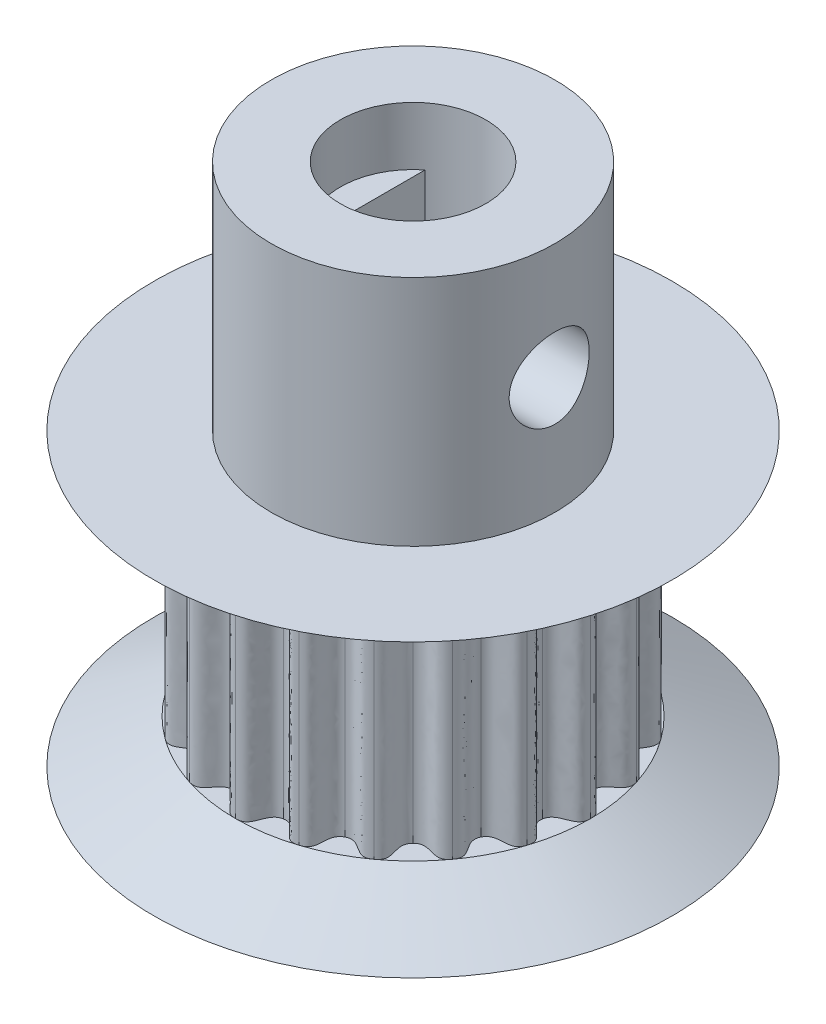
from build123d import *
from build123d.topology import SkipClean

# Parameters (mm, degrees)
BOSS_EXTRUDE3_DEPTH     = 3.5
SKETCH4_R               = 8.9
SKETCH3_R               = 6.1
SKETCH5_R               = 4.875
SKETCH5_R_2             = 2.5
BOSS_EXTRUDE4_DEPTH     = 8
CUT_EXTRUDE1_REACH      = 20.905
CUT_EXTRUDE1_END_RADIUS = 4.875
SKETCH6_R               = 1.375
SKETCH7_R               = 2.5
CUT_EXTRUDE2_DEPTH      = 2


with BuildPart() as part:
    # Sketch2 → Boss-Extrude3 (new, symmetric)
    with BuildSketch(Plane(origin=(0, 0, 0), x_dir=(1, 0, 0), z_dir=(0, 1, 0))):
        with BuildLine():
            add(Edge.make_bspline(
                [(0, 6.1), (0.152993891, 6.1), (0.490238058, 5.941777113), (0.471642161, 5.341987643), (0.836924388, 5.284132622)],
                knots=[0, 0, 0, 0, 0.268002773, 1, 1, 1, 1], degree=3))
            add(Edge.make_bspline(
                [(1.885003666, 5.801444749), (1.739497829, 5.848722462), (1.369866005, 5.802457733), (1.202206615, 5.226277601), (0.836924388, 5.284132622)],
                knots=[0, 0, 0, 0, 0.268002773, 1, 1, 1, 1], degree=3))
            add(Edge.make_bspline(
                [(1.885003666, 5.801444749), (2.030509503, 5.754167037), (2.302354204, 5.499473951), (2.099323316, 4.934786715), (2.428849174, 4.766884904)],
                knots=[0, 0, 0, 0, 0.268002773, 1, 1, 1, 1], degree=3))
            add(Edge.make_bspline(
                [(3.585490039, 4.935003666), (3.461715381, 5.024931219), (3.095878039, 5.095153362), (2.758375031, 4.598983094), (2.428849174, 4.766884904)],
                knots=[0, 0, 0, 0, 0.268002773, 1, 1, 1, 1], degree=3))
            add(Edge.make_bspline(
                [(3.585490039, 4.935003666), (3.709264697, 4.845076113), (3.88909988, 4.518843961), (3.521508078, 4.044534481), (3.783021279, 3.783021279)],
                knots=[0, 0, 0, 0, 0.268002773, 1, 1, 1, 1], degree=3))
            add(Edge.make_bspline(
                [(4.935003666, 3.585490039), (4.845076113, 3.709264697), (4.518843961, 3.88909988), (4.044534481, 3.521508078), (3.783021279, 3.783021279)],
                knots=[0, 0, 0, 0, 0.268002773, 1, 1, 1, 1], degree=3))
            add(Edge.make_bspline(
                [(4.935003666, 3.585490039), (5.024931219, 3.461715381), (5.095153362, 3.095878039), (4.598983094, 2.758375031), (4.766884904, 2.428849174)],
                knots=[0, 0, 0, 0, 0.268002773, 1, 1, 1, 1], degree=3))
            add(Edge.make_bspline(
                [(5.801444749, 1.885003666), (5.754167037, 2.030509503), (5.499473951, 2.302354204), (4.934786715, 2.099323316), (4.766884904, 2.428849174)],
                knots=[0, 0, 0, 0, 0.268002773, 1, 1, 1, 1], degree=3))
            add(Edge.make_bspline(
                [(5.801444749, 1.885003666), (5.848722462, 1.739497829), (5.802457733, 1.369866005), (5.226277601, 1.202206615), (5.284132622, 0.836924388)],
                knots=[0, 0, 0, 0, 0.268002773, 1, 1, 1, 1], degree=3))
            add(Edge.make_bspline(
                [(6.1, 0), (6.1, 0.152993891), (5.941777113, 0.490238058), (5.341987643, 0.471642161), (5.284132622, 0.836924388)],
                knots=[0, 0, 0, 0, 0.268002773, 1, 1, 1, 1], degree=3))
            add(Edge.make_bspline(
                [(6.1, 0), (6.1, -0.152993891), (5.941777113, -0.490238058), (5.341987643, -0.471642161), (5.284132622, -0.836924388)],
                knots=[0, 0, 0, 0, 0.268002773, 1, 1, 1, 1], degree=3))
            add(Edge.make_bspline(
                [(5.801444749, -1.885003666), (5.848722462, -1.739497829), (5.802457733, -1.369866005), (5.226277601, -1.202206615), (5.284132622, -0.836924388)],
                knots=[0, 0, 0, 0, 0.268002773, 1, 1, 1, 1], degree=3))
            add(Edge.make_bspline(
                [(5.801444749, -1.885003666), (5.754167037, -2.030509503), (5.499473951, -2.302354204), (4.934786715, -2.099323316), (4.766884904, -2.428849174)],
                knots=[0, 0, 0, 0, 0.268002773, 1, 1, 1, 1], degree=3))
            add(Edge.make_bspline(
                [(4.935003666, -3.585490039), (5.024931219, -3.461715381), (5.095153362, -3.095878039), (4.598983094, -2.758375031), (4.766884904, -2.428849174)],
                knots=[0, 0, 0, 0, 0.268002773, 1, 1, 1, 1], degree=3))
            add(Edge.make_bspline(
                [(4.935003666, -3.585490039), (4.845076113, -3.709264697), (4.518843961, -3.88909988), (4.044534481, -3.521508078), (3.783021279, -3.783021279)],
                knots=[0, 0, 0, 0, 0.268002773, 1, 1, 1, 1], degree=3))
            add(Edge.make_bspline(
                [(3.585490039, -4.935003666), (3.709264697, -4.845076113), (3.88909988, -4.518843961), (3.521508078, -4.044534481), (3.783021279, -3.783021279)],
                knots=[0, 0, 0, 0, 0.268002773, 1, 1, 1, 1], degree=3))
            add(Edge.make_bspline(
                [(3.585490039, -4.935003666), (3.461715381, -5.024931219), (3.095878039, -5.095153362), (2.758375031, -4.598983094), (2.428849174, -4.766884904)],
                knots=[0, 0, 0, 0, 0.268002773, 1, 1, 1, 1], degree=3))
            add(Edge.make_bspline(
                [(1.885003666, -5.801444749), (2.030509503, -5.754167037), (2.302354204, -5.499473951), (2.099323316, -4.934786715), (2.428849174, -4.766884904)],
                knots=[0, 0, 0, 0, 0.268002773, 1, 1, 1, 1], degree=3))
            add(Edge.make_bspline(
                [(1.885003666, -5.801444749), (1.739497829, -5.848722462), (1.369866005, -5.802457733), (1.202206615, -5.226277601), (0.836924388, -5.284132622)],
                knots=[0, 0, 0, 0, 0.268002773, 1, 1, 1, 1], degree=3))
            add(Edge.make_bspline(
                [(0, -6.1), (0.152993891, -6.1), (0.490238058, -5.941777113), (0.471642161, -5.341987643), (0.836924388, -5.284132622)],
                knots=[0, 0, 0, 0, 0.268002773, 1, 1, 1, 1], degree=3))
            add(Edge.make_bspline(
                [(0, -6.1), (-0.152993891, -6.1), (-0.490238058, -5.941777113), (-0.471642161, -5.341987643), (-0.836924388, -5.284132622)],
                knots=[0, 0, 0, 0, 0.268002773, 1, 1, 1, 1], degree=3))
            add(Edge.make_bspline(
                [(-1.885003666, -5.801444749), (-1.739497829, -5.848722462), (-1.369866005, -5.802457733), (-1.202206615, -5.226277601), (-0.836924388, -5.284132622)],
                knots=[0, 0, 0, 0, 0.268002773, 1, 1, 1, 1], degree=3))
            add(Edge.make_bspline(
                [(-1.885003666, -5.801444749), (-2.030509503, -5.754167037), (-2.302354204, -5.499473951), (-2.099323316, -4.934786715), (-2.428849174, -4.766884904)],
                knots=[0, 0, 0, 0, 0.268002773, 1, 1, 1, 1], degree=3))
            add(Edge.make_bspline(
                [(-3.585490039, -4.935003666), (-3.461715381, -5.024931219), (-3.095878039, -5.095153362), (-2.758375031, -4.598983094), (-2.428849174, -4.766884904)],
                knots=[0, 0, 0, 0, 0.268002773, 1, 1, 1, 1], degree=3))
            add(Edge.make_bspline(
                [(-3.585490039, -4.935003666), (-3.709264697, -4.845076113), (-3.88909988, -4.518843961), (-3.521508078, -4.044534481), (-3.783021279, -3.783021279)],
                knots=[0, 0, 0, 0, 0.268002773, 1, 1, 1, 1], degree=3))
            add(Edge.make_bspline(
                [(-4.935003666, -3.585490039), (-4.845076113, -3.709264697), (-4.518843961, -3.88909988), (-4.044534481, -3.521508078), (-3.783021279, -3.783021279)],
                knots=[0, 0, 0, 0, 0.268002773, 1, 1, 1, 1], degree=3))
            add(Edge.make_bspline(
                [(-4.935003666, -3.585490039), (-5.024931219, -3.461715381), (-5.095153362, -3.095878039), (-4.598983094, -2.758375031), (-4.766884904, -2.428849174)],
                knots=[0, 0, 0, 0, 0.268002773, 1, 1, 1, 1], degree=3))
            add(Edge.make_bspline(
                [(-5.801444749, -1.885003666), (-5.754167037, -2.030509503), (-5.499473951, -2.302354204), (-4.934786715, -2.099323316), (-4.766884904, -2.428849174)],
                knots=[0, 0, 0, 0, 0.268002773, 1, 1, 1, 1], degree=3))
            add(Edge.make_bspline(
                [(-5.801444749, -1.885003666), (-5.848722462, -1.739497829), (-5.802457733, -1.369866005), (-5.226277601, -1.202206615), (-5.284132622, -0.836924388)],
                knots=[0, 0, 0, 0, 0.268002773, 1, 1, 1, 1], degree=3))
            add(Edge.make_bspline(
                [(-6.1, 0), (-6.1, -0.152993891), (-5.941777113, -0.490238058), (-5.341987643, -0.471642161), (-5.284132622, -0.836924388)],
                knots=[0, 0, 0, 0, 0.268002773, 1, 1, 1, 1], degree=3))
            add(Edge.make_bspline(
                [(-6.1, 0), (-6.1, 0.152993891), (-5.941777113, 0.490238058), (-5.341987643, 0.471642161), (-5.284132622, 0.836924388)],
                knots=[0, 0, 0, 0, 0.268002773, 1, 1, 1, 1], degree=3))
            add(Edge.make_bspline(
                [(-5.801444749, 1.885003666), (-5.848722462, 1.739497829), (-5.802457733, 1.369866005), (-5.226277601, 1.202206615), (-5.284132622, 0.836924388)],
                knots=[0, 0, 0, 0, 0.268002773, 1, 1, 1, 1], degree=3))
            add(Edge.make_bspline(
                [(-5.801444749, 1.885003666), (-5.754167037, 2.030509503), (-5.499473951, 2.302354204), (-4.934786715, 2.099323316), (-4.766884904, 2.428849174)],
                knots=[0, 0, 0, 0, 0.268002773, 1, 1, 1, 1], degree=3))
            add(Edge.make_bspline(
                [(-4.935003666, 3.585490039), (-5.024931219, 3.461715381), (-5.095153362, 3.095878039), (-4.598983094, 2.758375031), (-4.766884904, 2.428849174)],
                knots=[0, 0, 0, 0, 0.268002773, 1, 1, 1, 1], degree=3))
            add(Edge.make_bspline(
                [(-4.935003666, 3.585490039), (-4.845076113, 3.709264697), (-4.518843961, 3.88909988), (-4.044534481, 3.521508078), (-3.783021279, 3.783021279)],
                knots=[0, 0, 0, 0, 0.268002773, 1, 1, 1, 1], degree=3))
            add(Edge.make_bspline(
                [(-3.585490039, 4.935003666), (-3.709264697, 4.845076113), (-3.88909988, 4.518843961), (-3.521508078, 4.044534481), (-3.783021279, 3.783021279)],
                knots=[0, 0, 0, 0, 0.268002773, 1, 1, 1, 1], degree=3))
            add(Edge.make_bspline(
                [(-3.585490039, 4.935003666), (-3.461715381, 5.024931219), (-3.095878039, 5.095153362), (-2.758375031, 4.598983094), (-2.428849174, 4.766884904)],
                knots=[0, 0, 0, 0, 0.268002773, 1, 1, 1, 1], degree=3))
            add(Edge.make_bspline(
                [(-1.885003666, 5.801444749), (-2.030509503, 5.754167037), (-2.302354204, 5.499473951), (-2.099323316, 4.934786715), (-2.428849174, 4.766884904)],
                knots=[0, 0, 0, 0, 0.268002773, 1, 1, 1, 1], degree=3))
            add(Edge.make_bspline(
                [(-1.885003666, 5.801444749), (-1.739497829, 5.848722462), (-1.369866005, 5.802457733), (-1.202206615, 5.226277601), (-0.836924388, 5.284132622)],
                knots=[0, 0, 0, 0, 0.268002773, 1, 1, 1, 1], degree=3))
            add(Edge.make_bspline(
                [(0, 6.1), (-0.152993891, 6.1), (-0.490238058, 5.941777113), (-0.471642161, 5.341987643), (-0.836924388, 5.284132622)],
                knots=[0, 0, 0, 0, 0.268002773, 1, 1, 1, 1], degree=3))
        make_face()
    extrude(amount=BOSS_EXTRUDE3_DEPTH, both=True)


with BuildPart() as body_2:
    # Sketch4 → Loft1 section 0
    with BuildSketch(Plane(origin=(0, -5, 0), x_dir=(-1, 0, 0), z_dir=(0, -1, 0))):
        Circle(SKETCH4_R)
    # Sketch3 → Loft1 section 1
    with BuildSketch(Plane.XZ.offset(3.5)):
        Circle(SKETCH3_R)
    loft()


with BuildPart() as body_3:
    # Mirror1: mirrored copy
    add(body_2.part.mirror(Plane.ZX))


with BuildPart() as body_2_1:
    add(body_2.part)

    # Combine1: union part, body 3
    add(part.part)
    add(body_3.part)

    # Sketch5 → Boss-Extrude4 (add)
    # profile 1 of 3: a face of its own
    with BuildSketch(Plane(origin=(0, 5, 0), x_dir=(1, 0, 0), z_dir=(0, 1, 0))):
        with Locations(Location((0, 0, 0), (0, 0, 270))):
            Circle(SKETCH5_R)
        Circle(SKETCH5_R_2, mode=Mode.SUBTRACT)
    # profile 2 of 3: a face of its own
    with BuildSketch(Plane(origin=(0, 5, 0), x_dir=(1, 0, 0), z_dir=(0, 1, 0))):
        with BuildLine():
            Line((-1.55, -1.961504525), (-1.55, 1.961504525))
            ThreePointArc((-1.55, 1.961504525), (-2.5, 0), (-1.55, -1.961504525))
        make_face()
    # profile 3 of 3: a face of its own
    with BuildSketch(Plane(origin=(0, 5, 0), x_dir=(1, 0, 0), z_dir=(0, 1, 0))):
        with BuildLine():
            ThreePointArc((2.5, 0), (2.25, 1.089724736), (1.55, 1.961504525))
            Line((1.55, 1.961504525), (1.55, -1.961504525))
            ThreePointArc((1.55, -1.961504525), (2.25, -1.089724736), (2.5, 0))
        make_face()
    extrude(amount=BOSS_EXTRUDE4_DEPTH)

    # Cut-Extrude1: up to this cylinder (the profile starts inside it)
    cut_extrude1_end = Plane(origin=(0, 9, 0), z_dir=(0, -1, 0)) * Cylinder(CUT_EXTRUDE1_END_RADIUS, 52.56, mode=Mode.PRIVATE)
    # Sketch6 → Cut-Extrude1 (cut, up to the surface)
    with BuildSketch(Plane(origin=(-1.55, 0, 0), x_dir=(0, 0, -1), z_dir=(1, 0, 0)), mode=Mode.PRIVATE) as cut_extrude1_sk1:
        with Locations(Location((0, 9, 0), (0, 0, 180))):
            Circle(SKETCH6_R)
    cut_extrude1_tool1 = extrude(cut_extrude1_sk1.sketch, amount=CUT_EXTRUDE1_REACH, mode=Mode.PRIVATE) & cut_extrude1_end
    add(cut_extrude1_tool1.solids().sort_by_distance((-1.55, 9, 0))[0], mode=Mode.SUBTRACT)

    # Sketch7 → Cut-Extrude2 (cut)
    with SkipClean():  # the faces are left unmerged after this step: merging them gives an invalid solid
        with BuildSketch(Plane(origin=(0, 13, 0), x_dir=(1, 0, 0), z_dir=(0, 1, 0))):
            with Locations(Location((0, 0, 0), (0, 0, 51.683865526))):
                Circle(SKETCH7_R)
        extrude(amount=-CUT_EXTRUDE2_DEPTH, mode=Mode.SUBTRACT)


solid = body_2_1.part
